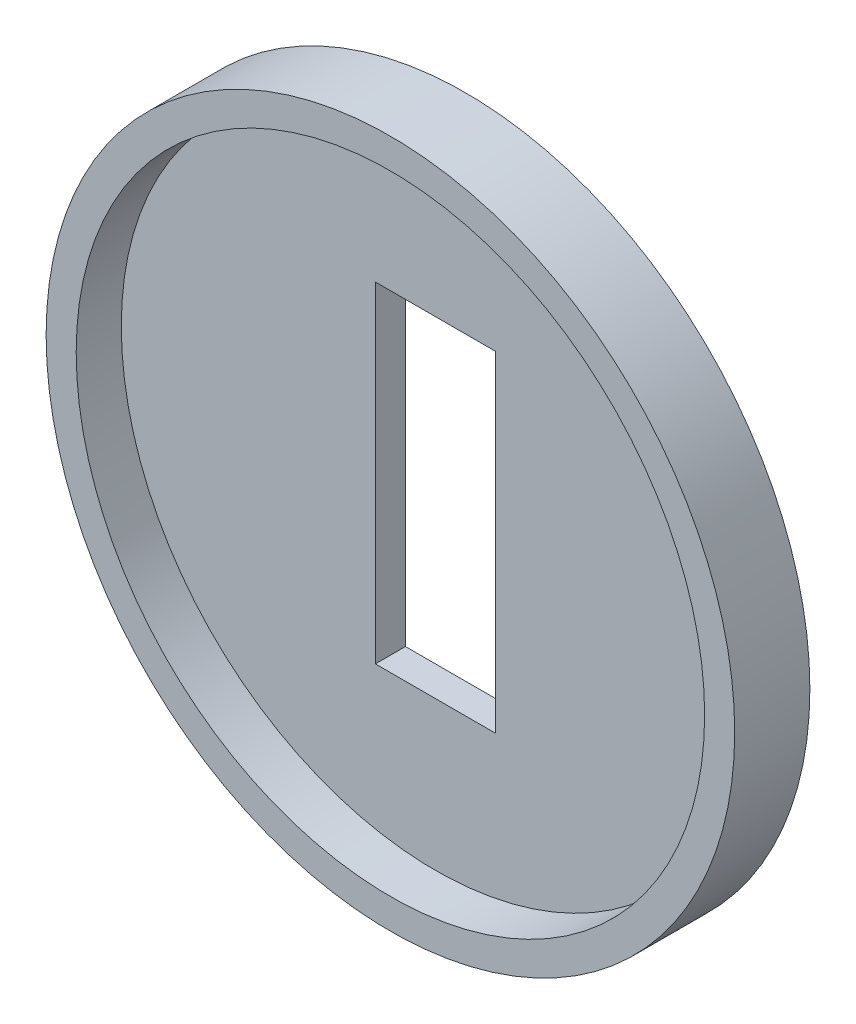
from build123d import *

# Parameters (mm, degrees)
SKIZZE2_W                       = 8
SKIZZE2_H                       = 22
SCHNITT_LINEAR_AUSTRAGEN1_DEPTH = 10


with BuildPart() as part:
    # Skizze1 → Rotation2 (revolve)
    with BuildSketch(Plane(origin=(0, 0, 0), x_dir=(1, 0, 0), z_dir=(0, 1, 0))):
        Polygon((0, 0), (22.902, 0), (22.902, -5), (20.902, -5), (20.902, -2), (0, -2), align=None)
    revolve(axis=Axis((0, 0, 2), (0, 0, -1)))

    # Skizze2 → Schnitt-Linear austragen1 (cut)
    with BuildSketch(Plane(origin=(0, 0, 0), x_dir=(-1, 0, 0), z_dir=(0, 0, -1))):
        Rectangle(SKIZZE2_W, SKIZZE2_H)
    extrude(amount=-SCHNITT_LINEAR_AUSTRAGEN1_DEPTH, mode=Mode.SUBTRACT)


solid = part.part
